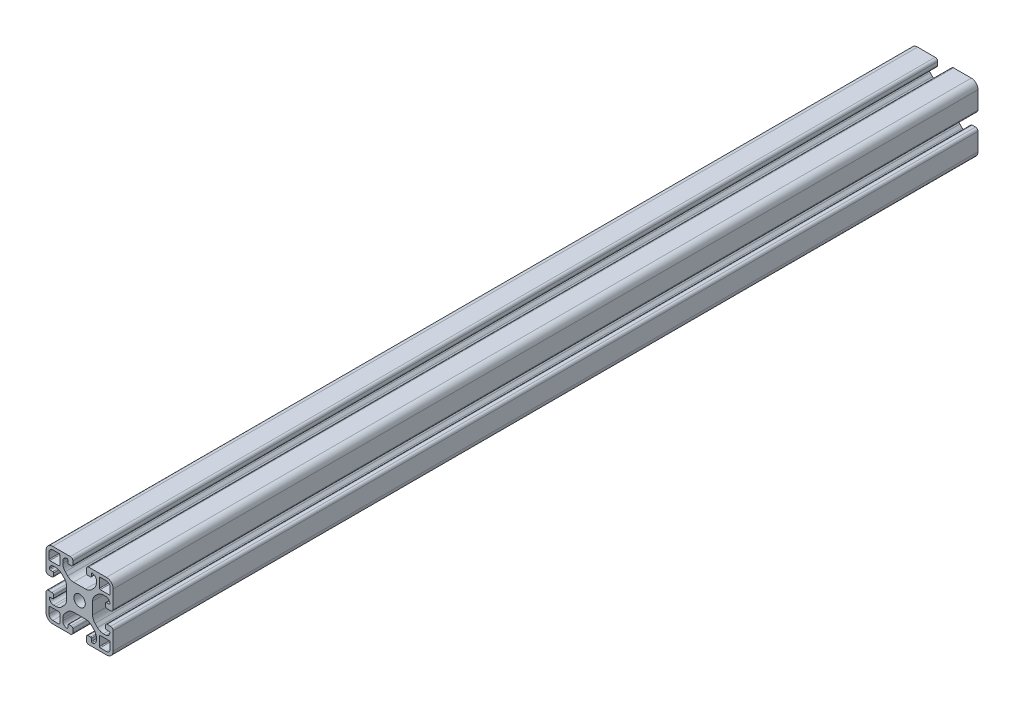
from build123d import *

# Parameters (mm, degrees)
ESQUISSE1_R        = 3.4
BOSS_EXTRU_1_DEPTH = 515


with BuildPart() as part:
    # Esquisse1 → Boss.-Extru.1 (new body)
    with BuildSketch(Plane(origin=(0, 0, -30), x_dir=(-1, 0, 0), z_dir=(0, 0, -1))):
        with BuildLine():
            Line((-4.5, 15), (-4.5, 13.5))
            ThreePointArc((-4.5, 13.5), (-4.353553391, 13.146446609), (-4, 13))
            Line((-4, 13), (-2.5, 13))
            ThreePointArc((-2.5, 13), (-2.146446609, 12.853553391), (-2, 12.5))
            ThreePointArc((-2, 12.5), (-2.732233047, 10.732233047), (-4.5, 10))
            Line((-4.5, 10), (-5.807611845, 10))
            ThreePointArc((-5.807611845, 10), (-7.721029006, 10.380602337), (-9.343145751, 11.464466094))
            Line((-9.343145751, 11.464466094), (-10.785533906, 12.906854249))
            ThreePointArc((-10.785533906, 12.906854249), (-11.869397663, 14.528970994), (-12.25, 16.442388155))
            Line((-12.25, 16.442388155), (-12.25, 23.557611845))
            ThreePointArc((-12.25, 23.557611845), (-11.869397663, 25.471029006), (-10.785533906, 27.093145751))
            Line((-10.785533906, 27.093145751), (-9.343145751, 28.535533906))
            ThreePointArc((-9.343145751, 28.535533906), (-7.721029006, 29.619397663), (-5.807611845, 30))
            Line((-5.807611845, 30), (-4.5, 30))
            ThreePointArc((-4.5, 30), (-2.732233047, 29.267766953), (-2, 27.5))
            ThreePointArc((-2, 27.5), (-2.146446609, 27.146446609), (-2.5, 27))
            Line((-2.5, 27), (-4, 27))
            ThreePointArc((-4, 27), (-4.353553391, 26.853553391), (-4.5, 26.5))
            Line((-4.5, 26.5), (-4.5, 25))
            ThreePointArc((-4.5, 25), (-4.207106781, 24.292893219), (-3.5, 24))
            Line((-3.5, 24), (-1.5, 24))
            ThreePointArc((-1.5, 24), (-0.439339828, 24.439339828), (0, 25.5))
            Line((0, 25.5), (0, 36))
            ThreePointArc((0, 36), (-1.171572875, 38.828427125), (-4, 40))
            Line((-4, 40), (-14.5, 40))
            ThreePointArc((-14.5, 40), (-15.560660172, 39.560660172), (-16, 38.5))
            Line((-16, 38.5), (-16, 36.5))
            ThreePointArc((-16, 36.5), (-15.707106781, 35.792893219), (-15, 35.5))
            Line((-15, 35.5), (-13.5, 35.5))
            ThreePointArc((-13.5, 35.5), (-13.146446609, 35.646446609), (-13, 36))
            Line((-13, 36), (-13, 37.5))
            ThreePointArc((-13, 37.5), (-12.853553391, 37.853553391), (-12.5, 38))
            ThreePointArc((-12.5, 38), (-10.732233047, 37.267766953), (-10, 35.5))
            Line((-10, 35.5), (-10, 34.192388155))
            ThreePointArc((-10, 34.192388155), (-10.380602337, 32.278970994), (-11.464466094, 30.656854249))
            Line((-11.464466094, 30.656854249), (-12.906854249, 29.214466094))
            ThreePointArc((-12.906854249, 29.214466094), (-14.528970994, 28.130602337), (-16.442388155, 27.75))
            Line((-16.442388155, 27.75), (-23.557611845, 27.75))
            ThreePointArc((-23.557611845, 27.75), (-25.471029006, 28.130602337), (-27.093145751, 29.214466094))
            Line((-27.093145751, 29.214466094), (-28.535533906, 30.656854249))
            ThreePointArc((-28.535533906, 30.656854249), (-29.619397663, 32.278970994), (-30, 34.192388155))
            Line((-30, 34.192388155), (-30, 35.5))
            ThreePointArc((-30, 35.5), (-29.267766953, 37.267766953), (-27.5, 38))
            ThreePointArc((-27.5, 38), (-27.146446609, 37.853553391), (-27, 37.5))
            Line((-27, 37.5), (-27, 36))
            ThreePointArc((-27, 36), (-26.853553391, 35.646446609), (-26.5, 35.5))
            Line((-26.5, 35.5), (-25, 35.5))
            ThreePointArc((-25, 35.5), (-24.292893219, 35.792893219), (-24, 36.5))
            Line((-24, 36.5), (-24, 38.5))
            ThreePointArc((-24, 38.5), (-24.439339828, 39.560660172), (-25.5, 40))
            Line((-25.5, 40), (-36, 40))
            ThreePointArc((-36, 40), (-38.828427125, 38.828427125), (-40, 36))
            Line((-40, 36), (-40, 25.5))
            ThreePointArc((-40, 25.5), (-39.560660172, 24.439339828), (-38.5, 24))
            Line((-38.5, 24), (-36.5, 24))
            ThreePointArc((-36.5, 24), (-35.792893219, 24.292893219), (-35.5, 25))
            Line((-35.5, 25), (-35.5, 26.5))
            ThreePointArc((-35.5, 26.5), (-35.646446609, 26.853553391), (-36, 27))
            Line((-36, 27), (-37.5, 27))
            ThreePointArc((-37.5, 27), (-37.853553391, 27.146446609), (-38, 27.5))
            ThreePointArc((-38, 27.5), (-37.267766953, 29.267766953), (-35.5, 30))
            Line((-35.5, 30), (-34.192388155, 30))
            ThreePointArc((-34.192388155, 30), (-32.278970994, 29.619397663), (-30.656854249, 28.535533906))
            Line((-30.656854249, 28.535533906), (-29.214466094, 27.093145751))
            ThreePointArc((-29.214466094, 27.093145751), (-28.130602337, 25.471029006), (-27.75, 23.557611845))
            Line((-27.75, 23.557611845), (-27.75, 16.442388155))
            ThreePointArc((-27.75, 16.442388155), (-28.130602337, 14.528970994), (-29.214466094, 12.906854249))
            Line((-29.214466094, 12.906854249), (-30.656854249, 11.464466094))
            ThreePointArc((-30.656854249, 11.464466094), (-32.278970994, 10.380602337), (-34.192388155, 10))
            Line((-34.192388155, 10), (-35.5, 10))
            ThreePointArc((-35.5, 10), (-37.267766953, 10.732233047), (-38, 12.5))
            ThreePointArc((-38, 12.5), (-37.853553391, 12.853553391), (-37.5, 13))
            Line((-37.5, 13), (-36, 13))
            ThreePointArc((-36, 13), (-35.646446609, 13.146446609), (-35.5, 13.5))
            Line((-35.5, 13.5), (-35.5, 15))
            ThreePointArc((-35.5, 15), (-35.792893219, 15.707106781), (-36.5, 16))
            Line((-36.5, 16), (-38.5, 16))
            ThreePointArc((-38.5, 16), (-39.560660172, 15.560660172), (-40, 14.5))
            Line((-40, 14.5), (-40, 4))
            ThreePointArc((-40, 4), (-38.828427125, 1.171572875), (-36, 0))
            Line((-36, 0), (-25.5, 0))
            ThreePointArc((-25.5, 0), (-24.439339828, 0.439339828), (-24, 1.5))
            Line((-24, 1.5), (-24, 3.5))
            ThreePointArc((-24, 3.5), (-24.292893219, 4.207106781), (-25, 4.5))
            Line((-25, 4.5), (-26.5, 4.5))
            ThreePointArc((-26.5, 4.5), (-26.853553391, 4.353553391), (-27, 4))
            Line((-27, 4), (-27, 2.5))
            ThreePointArc((-27, 2.5), (-27.146446609, 2.146446609), (-27.5, 2))
            ThreePointArc((-27.5, 2), (-29.267766953, 2.732233047), (-30, 4.5))
            Line((-30, 4.5), (-30, 5.807611845))
            ThreePointArc((-30, 5.807611845), (-29.619397663, 7.721029006), (-28.535533906, 9.343145751))
            Line((-28.535533906, 9.343145751), (-27.093145751, 10.785533906))
            ThreePointArc((-27.093145751, 10.785533906), (-25.471029006, 11.869397663), (-23.557611845, 12.25))
            Line((-23.557611845, 12.25), (-16.442388155, 12.25))
            ThreePointArc((-16.442388155, 12.25), (-14.528970994, 11.869397663), (-12.906854249, 10.785533906))
            Line((-12.906854249, 10.785533906), (-11.464466094, 9.343145751))
            ThreePointArc((-11.464466094, 9.343145751), (-10.380602337, 7.721029006), (-10, 5.807611845))
            Line((-10, 5.807611845), (-10, 4.5))
            ThreePointArc((-10, 4.5), (-10.732233047, 2.732233047), (-12.5, 2))
            ThreePointArc((-12.5, 2), (-12.853553391, 2.146446609), (-13, 2.5))
            Line((-13, 2.5), (-13, 4))
            ThreePointArc((-13, 4), (-13.146446609, 4.353553391), (-13.5, 4.5))
            Line((-13.5, 4.5), (-15, 4.5))
            ThreePointArc((-15, 4.5), (-15.707106781, 4.207106781), (-16, 3.5))
            Line((-16, 3.5), (-16, 1.5))
            ThreePointArc((-16, 1.5), (-15.560660172, 0.439339828), (-14.5, 0))
            Line((-14.5, 0), (-4, 0))
            ThreePointArc((-4, 0), (-1.171572875, 1.171572875), (0, 4))
            Line((0, 4), (0, 14.5))
            ThreePointArc((0, 14.5), (-0.439339828, 15.560660172), (-1.5, 16))
            Line((-1.5, 16), (-3.5, 16))
            ThreePointArc((-3.5, 16), (-4.207106781, 15.707106781), (-4.5, 15))
        make_face()
        with Locations(Location((-20, 20, 0), (0, 0, 180))):
            Circle(ESQUISSE1_R, mode=Mode.SUBTRACT)
        with BuildLine():
            Line((-4, 1.8), (-7.7, 1.8))
            ThreePointArc((-7.7, 1.8), (-8.053553391, 1.946446609), (-8.2, 2.3))
            Line((-8.2, 2.3), (-8.2, 7.7))
            ThreePointArc((-8.2, 7.7), (-8.053553391, 8.053553391), (-7.7, 8.2))
            Line((-7.7, 8.2), (-2.3, 8.2))
            ThreePointArc((-2.3, 8.2), (-1.946446609, 8.053553391), (-1.8, 7.7))
            Line((-1.8, 7.7), (-1.8, 4))
            ThreePointArc((-1.8, 4), (-2.444365081, 2.444365081), (-4, 1.8))
        make_face(mode=Mode.SUBTRACT)
        with BuildLine():
            Line((-38.2, 4), (-38.2, 7.7))
            ThreePointArc((-38.2, 7.7), (-38.053553391, 8.053553391), (-37.7, 8.2))
            Line((-37.7, 8.2), (-32.3, 8.2))
            ThreePointArc((-32.3, 8.2), (-31.946446609, 8.053553391), (-31.8, 7.7))
            Line((-31.8, 7.7), (-31.8, 2.3))
            ThreePointArc((-31.8, 2.3), (-31.946446609, 1.946446609), (-32.3, 1.8))
            Line((-32.3, 1.8), (-36, 1.8))
            ThreePointArc((-36, 1.8), (-37.555634919, 2.444365081), (-38.2, 4))
        make_face(mode=Mode.SUBTRACT)
        with BuildLine():
            Line((-36, 38.2), (-32.3, 38.2))
            ThreePointArc((-32.3, 38.2), (-31.946446609, 38.053553391), (-31.8, 37.7))
            Line((-31.8, 37.7), (-31.8, 32.3))
            ThreePointArc((-31.8, 32.3), (-31.946446609, 31.946446609), (-32.3, 31.8))
            Line((-32.3, 31.8), (-37.7, 31.8))
            ThreePointArc((-37.7, 31.8), (-38.053553391, 31.946446609), (-38.2, 32.3))
            Line((-38.2, 32.3), (-38.2, 36))
            ThreePointArc((-38.2, 36), (-37.555634919, 37.555634919), (-36, 38.2))
        make_face(mode=Mode.SUBTRACT)
        with BuildLine():
            Line((-1.8, 36), (-1.8, 32.3))
            ThreePointArc((-1.8, 32.3), (-1.946446609, 31.946446609), (-2.3, 31.8))
            Line((-2.3, 31.8), (-7.7, 31.8))
            ThreePointArc((-7.7, 31.8), (-8.053553391, 31.946446609), (-8.2, 32.3))
            Line((-8.2, 32.3), (-8.2, 37.7))
            ThreePointArc((-8.2, 37.7), (-8.053553391, 38.053553391), (-7.7, 38.2))
            Line((-7.7, 38.2), (-4, 38.2))
            ThreePointArc((-4, 38.2), (-2.444365081, 37.555634919), (-1.8, 36))
        make_face(mode=Mode.SUBTRACT)
    extrude(amount=-BOSS_EXTRU_1_DEPTH)


solid = part.part
